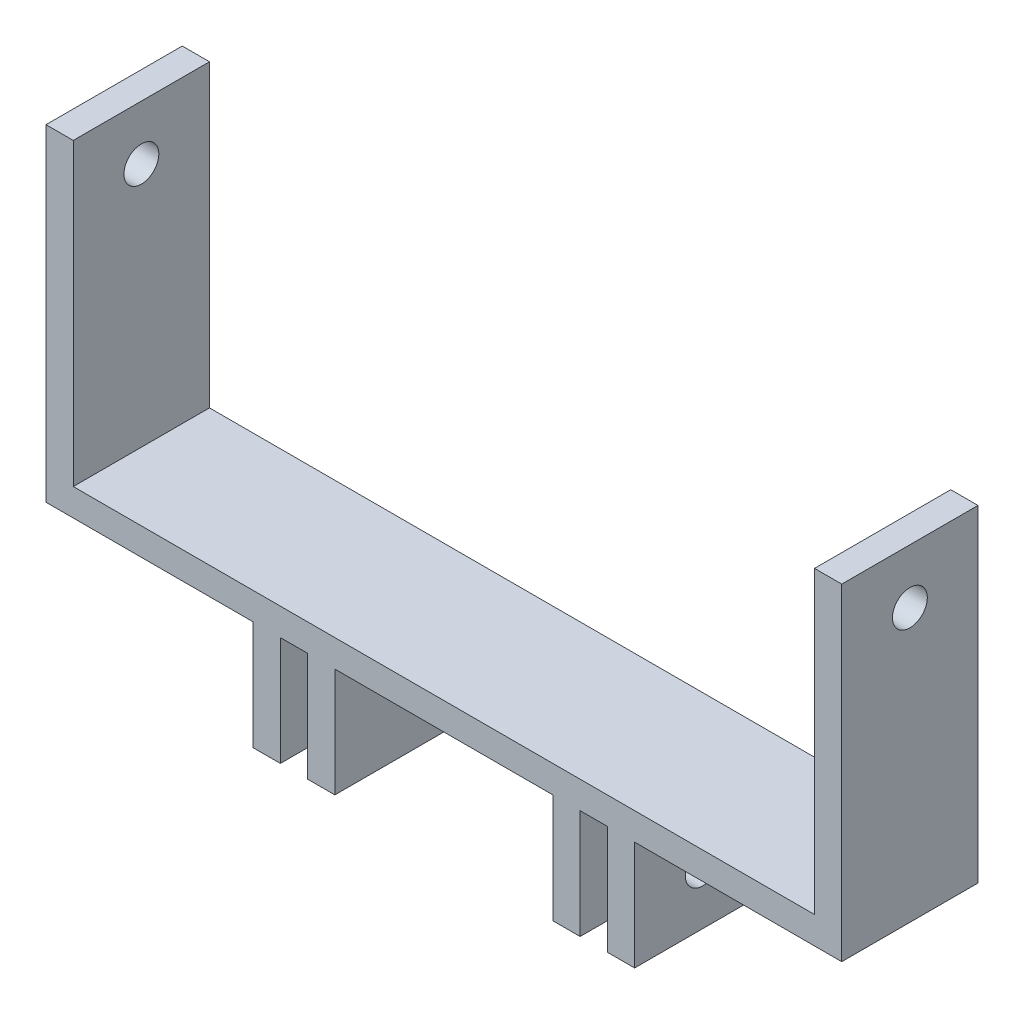
from build123d import *

# Parameters (mm, degrees)
BOSS_EXTRUDE1_DEPTH = 15.875
CUT_EXTRUDE2_REACH  = 49.811
SKETCH3_R           = 2.032
CUT_EXTRUDE3_REACH  = 64.068
SKETCH4_R           = 2.032


with BuildPart() as part:
    # Sketch1 → Boss-Extrude1 (new body)
    with BuildSketch(Plane.XY):
        Polygon((3.175, 3.175), (46.355, 3.175), (46.355, 0), (33.655, 0), (33.655, -12.7), (30.48, -12.7), (30.48, 0), (27.305, 0), (27.305, -12.7), (24.13, -12.7), (24.13, 0), (0, 0), (0, 38.1), (3.175, 38.1), align=None)
    boss_extrude1 = extrude(amount=BOSS_EXTRUDE1_DEPTH)

    # Sketch3 → Cut-Extrude2 (cut, up to next)
    with BuildSketch(Plane.ZY.offset(-24.13), mode=Mode.PRIVATE) as cut_extrude2_sk1:
        with Locations(Location((7.9375, -6.35, 0), (0, 0, 270))):
            Circle(SKETCH3_R)
    cut_extrude2_tool1 = extrude(cut_extrude2_sk1.sketch, amount=-CUT_EXTRUDE2_REACH, mode=Mode.PRIVATE) & part.part
    cut_extrude2 = cut_extrude2_tool1.solids().sort_by_distance((24.13, -6.35, 7.9375))[0]
    add(cut_extrude2, mode=Mode.SUBTRACT)

    # Sketch4 → Cut-Extrude3 (cut, up to next)
    with BuildSketch(Plane.ZY, mode=Mode.PRIVATE) as cut_extrude3_sk1:
        with Locations((7.9375, 31.75)):
            Circle(SKETCH4_R)
    cut_extrude3_tool1 = extrude(cut_extrude3_sk1.sketch, amount=-CUT_EXTRUDE3_REACH, mode=Mode.PRIVATE) & part.part
    cut_extrude3 = cut_extrude3_tool1.solids().sort_by_distance((0, 31.75, 7.9375))[0]
    add(cut_extrude3, mode=Mode.SUBTRACT)

    # Mirror2: Boss-Extrude1, Cut-Extrude2, Cut-Extrude3 across plane
    add(boss_extrude1.mirror(Plane(origin=(46.355, 0, 0), x_dir=(0, 0, 1), z_dir=(1, 0, 0))))
    add(cut_extrude2.mirror(Plane(origin=(46.355, 0, 0), x_dir=(0, 0, 1), z_dir=(1, 0, 0))), mode=Mode.SUBTRACT)
    add(cut_extrude3.mirror(Plane(origin=(46.355, 0, 0), x_dir=(0, 0, 1), z_dir=(1, 0, 0))), mode=Mode.SUBTRACT)


solid = part.part
